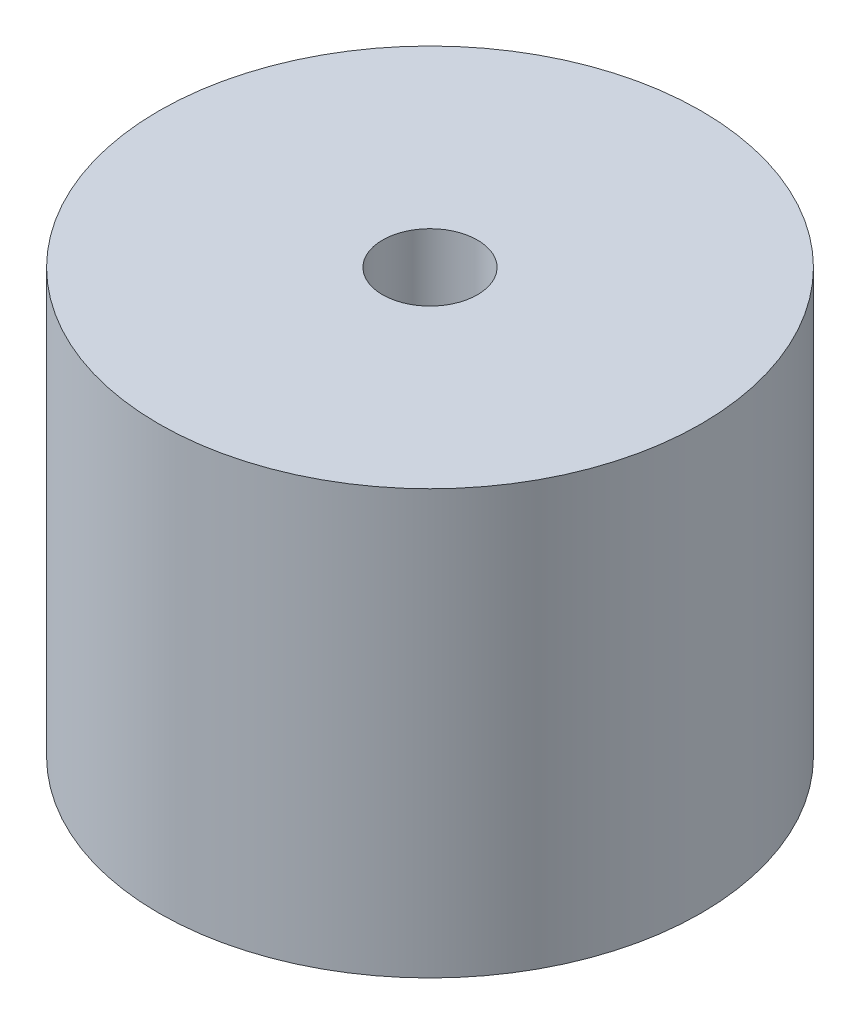
from build123d import *

# Parameters (mm, degrees)
SKETCH1_R           = 16
SKETCH1_R_2         = 2.8
BOSS_EXTRUDE1_DEPTH = 25


with BuildPart() as part:
    # Sketch1 → Boss-Extrude1 (new body)
    with BuildSketch(Plane(origin=(0, 0, 0), x_dir=(1, 0, 0), z_dir=(0, 1, 0))):
        with Locations(Location((0, 0, 0), (0, 0, 270))):
            Circle(SKETCH1_R)
        with Locations(Location((0, 0, 0), (0, 0, 270))):
            Circle(SKETCH1_R_2, mode=Mode.SUBTRACT)
    extrude(amount=-BOSS_EXTRUDE1_DEPTH)


solid = part.part
